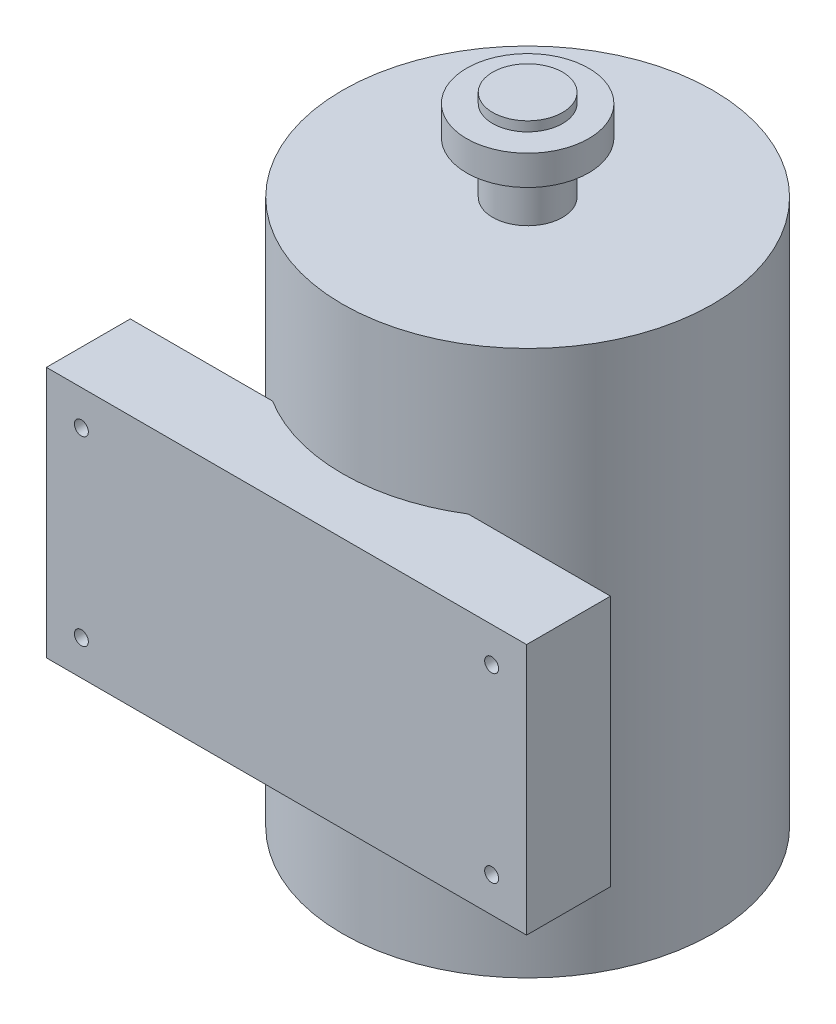
from build123d import *

# Parameters (mm, degrees)
SKETCH1_R           = 53
BOSS_EXTRUDE1_DEPTH = 78
SKETCH2_R           = 10
BOSS_EXTRUDE2_DEPTH = 26
SKETCH9_R           = 17.4625
BOSS_EXTRUDE4_DEPTH = 4.25
SKETCH12_W          = 137.4
SKETCH12_H          = 72
BOSS_EXTRUDE6_DEPTH = 24
SKETCH13_R          = 2
CUT_EXTRUDE2_DEPTH  = 24


with BuildPart() as part:
    # Sketch1 → Boss-Extrude1 (new, symmetric)
    with BuildSketch(Plane(origin=(0, 0, 0), x_dir=(1, 0, 0), z_dir=(0, 1, 0))):
        with Locations(Location((0, 0, 0), (0, 0, 270))):
            Circle(SKETCH1_R)
    extrude(amount=BOSS_EXTRUDE1_DEPTH, both=True)

    # Sketch2 → Boss-Extrude2 (add)
    with BuildSketch(Plane(origin=(0, 78, 0), x_dir=(1, 0, 0), z_dir=(0, 1, 0))):
        with Locations(Location((0, 0, 0), (0, 0, 90))):
            Circle(SKETCH2_R)
    extrude(amount=BOSS_EXTRUDE2_DEPTH)

    # Sketch9 → Boss-Extrude4 (add, symmetric)
    with BuildSketch(Plane(origin=(0, 97, 0), x_dir=(1, 0, 0), z_dir=(0, 1, 0))):
        with Locations(Location((0, 0, 0), (0, 0, 270))):
            Circle(SKETCH9_R)
    extrude(amount=BOSS_EXTRUDE4_DEPTH, both=True)

    # Sketch12 → Boss-Extrude6 (add)
    with BuildSketch(Plane(origin=(0, 0, 69), x_dir=(-1, 0, 0), z_dir=(0, 0, -1))):
        Rectangle(SKETCH12_W, SKETCH12_H)
    extrude(amount=BOSS_EXTRUDE6_DEPTH)

    # Sketch13 → Cut-Extrude2 (cut)
    with BuildSketch(Plane.XY.offset(69)):
        with Locations((-58.7, -26)):
            Circle(SKETCH13_R)
        with Locations((-58.7, 26)):
            Circle(SKETCH13_R)
        with Locations((58.7, 26)):
            Circle(SKETCH13_R)
        with Locations((58.7, -26)):
            Circle(SKETCH13_R)
    extrude(amount=-CUT_EXTRUDE2_DEPTH, mode=Mode.SUBTRACT)


solid = part.part
